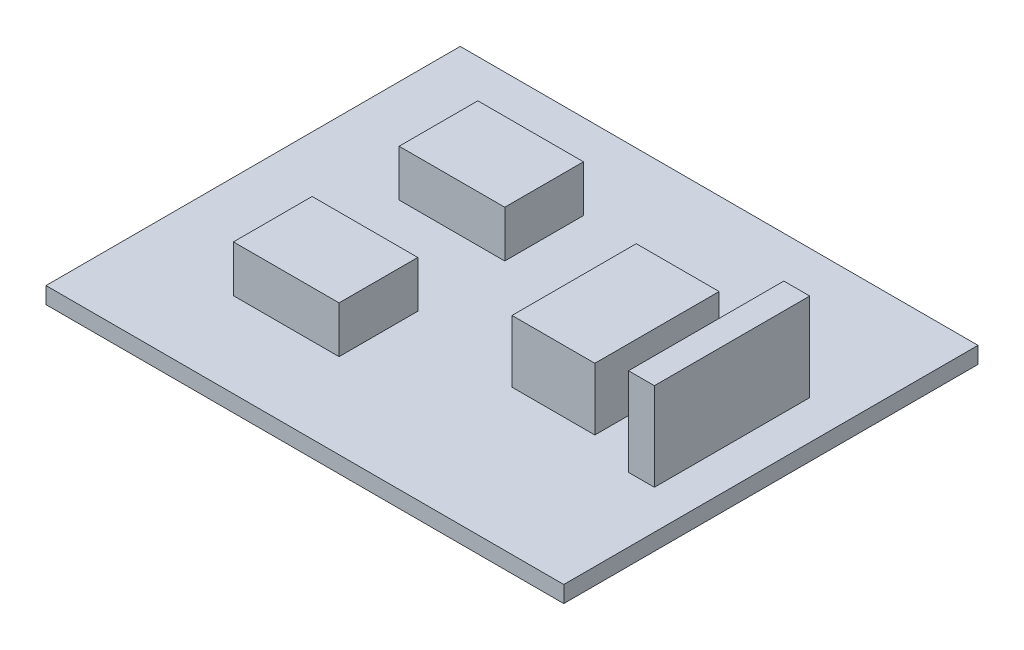
from build123d import *

# Parameters (mm, degrees)
SKETCH1_W          = 50
SKETCH1_H          = 40
BOARD_DEPTH        = 1.6
OPAMP_DIP8_1_START = 1.6
SKETCH2_W          = 10.2
SKETCH2_H          = 7.6
OPAMP_DIP8_1_DEPTH = 4.5
OPAMP_DIP8_2_START = 1.6
SKETCH3_W          = 10.2
SKETCH3_H          = 7.6
OPAMP_DIP8_2_DEPTH = 4.5
LED_DRIVER_START   = 1.6
SKETCH4_W          = 8
SKETCH4_H          = 12
LED_DRIVER_DEPTH   = 6
HEADER_START       = 1.6
SKETCH5_W          = 2.5
SKETCH5_H          = 15
HEADER_DEPTH       = 8.5


with BuildPart() as part:
    # Sketch1 → Board (new body)
    with BuildSketch(Plane(origin=(0, 0, 0), x_dir=(1, 0, 0), z_dir=(0, 1, 0))):
        Rectangle(SKETCH1_W, SKETCH1_H)
    extrude(amount=BOARD_DEPTH)

    # Sketch2 → OpAmp_DIP8_1 (add)
    with BuildSketch(Plane(origin=(0, 0, 0), x_dir=(1, 0, 0), z_dir=(0, 1, 0)).offset(OPAMP_DIP8_1_START)):
        with Locations((-10, 8)):
            Rectangle(SKETCH2_W, SKETCH2_H)
    extrude(amount=OPAMP_DIP8_1_DEPTH)

    # Sketch3 → OpAmp_DIP8_2 (add)
    with BuildSketch(Plane(origin=(0, 0, 0), x_dir=(1, 0, 0), z_dir=(0, 1, 0)).offset(OPAMP_DIP8_2_START)):
        with Locations((-10, -8)):
            Rectangle(SKETCH3_W, SKETCH3_H)
    extrude(amount=OPAMP_DIP8_2_DEPTH)

    # Sketch4 → LED_Driver (add)
    with BuildSketch(Plane(origin=(0, 0, 0), x_dir=(1, 0, 0), z_dir=(0, 1, 0)).offset(LED_DRIVER_START)):
        with Locations((10, 0)):
            Rectangle(SKETCH4_W, SKETCH4_H)
    extrude(amount=LED_DRIVER_DEPTH)

    # Sketch5 → Header (add)
    with BuildSketch(Plane(origin=(0, 0, 0), x_dir=(1, 0, 0), z_dir=(0, 1, 0)).offset(HEADER_START)):
        with Locations((20, 0)):
            Rectangle(SKETCH5_W, SKETCH5_H)
    extrude(amount=HEADER_DEPTH)


solid = part.part
